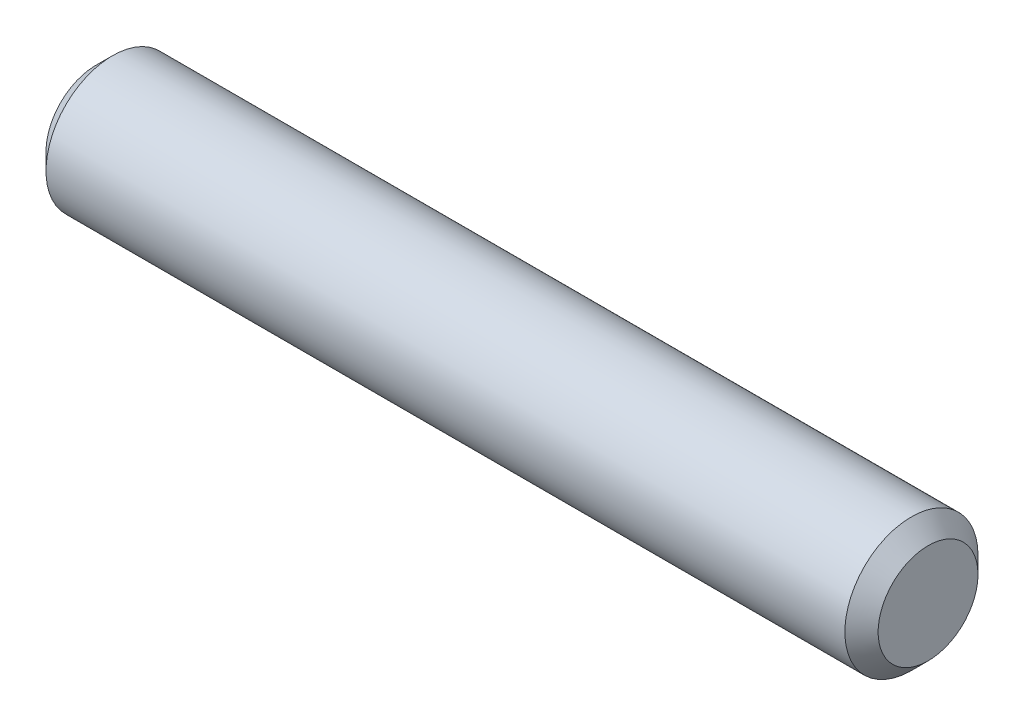
from build123d import *

# Parameters (mm, degrees)
SCHIZZO2_R                   = 4
ESTRUSIONE_ESTRUSIONE2_DEPTH = 50
SMUSSO2_SIZE                 = 1


with BuildPart() as part:
    # Schizzo2 → Estrusione-Estrusione2 (new body)
    with BuildSketch(Plane(origin=(0, 0, 0), x_dir=(0, 0, -1), z_dir=(1, 0, 0))):
        Circle(SCHIZZO2_R)
    extrude(amount=ESTRUSIONE_ESTRUSIONE2_DEPTH)

    # Smusso2
    smusso2_edges = [part.edges().sort_by_distance(p)[0] for p in [
        (0, 0, 4),
        (50, 0, 4),
    ]]
    chamfer(smusso2_edges, length=SMUSSO2_SIZE)


solid = part.part
